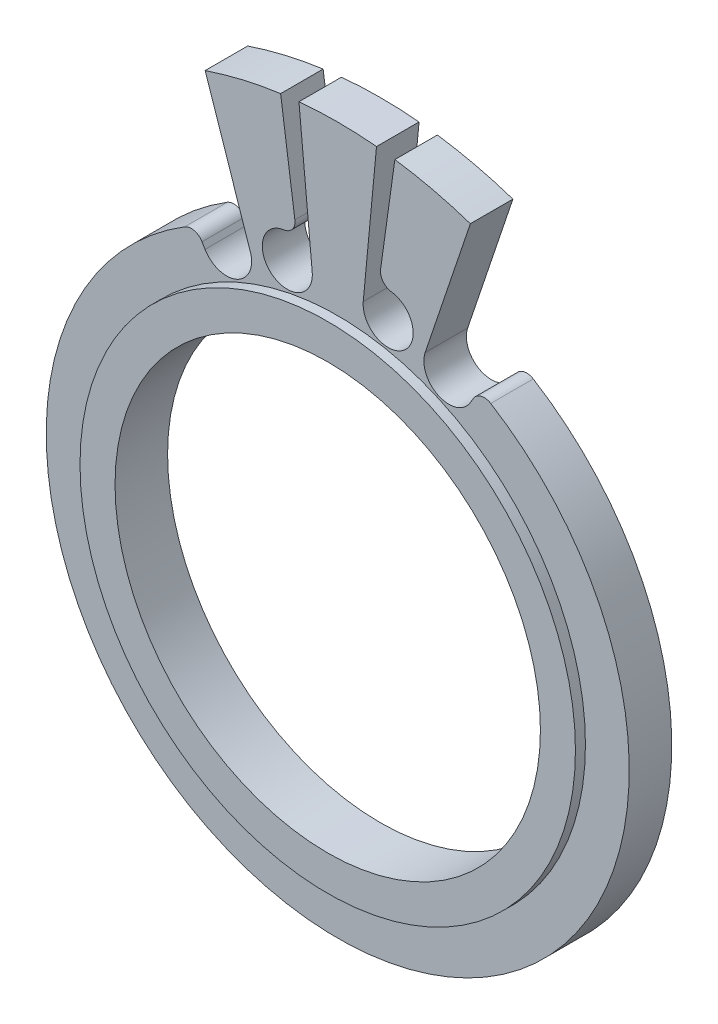
from build123d import *

# Parameters (mm, degrees)
ESQUISSE1_R        = 17
BOSS_EXTRU_1_DEPTH = 3.4
ESQUISSE2_R        = 19.8
ESQUISSE2_R_2      = 17
BOSS_EXTRU_2_DEPTH = 0.8


with BuildPart() as part:
    # Esquisse1 → Boss.-Extru.1 (new body)
    with BuildSketch(Plane.XY):
        with BuildLine():
            Line((10.604819554, 19.085304433), (10.844597942, 19.490397698))
            ThreePointArc((10.844597942, 19.490397698), (11.465620902, 19.951920532), (12.230041829, 19.832197983))
            ThreePointArc((12.230041829, 19.832197983), (0, -23.3), (-12.230041829, 19.832197983))
            ThreePointArc((-12.230041829, 19.832197983), (-11.465620902, 19.951920532), (-10.844597942, 19.490397698))
            Line((-10.844597942, 19.490397698), (-10.604819554, 19.085304433))
            ThreePointArc((-10.604819554, 19.085304433), (-8.050510374, 18.285863427), (-6.988397979, 20.74259267))
            Line((-6.988397979, 20.74259267), (-10.6, 31.462358462))
            ThreePointArc((-10.6, 31.462358462), (-7.615939872, 32.314663233), (-4.565333975, 32.884612294))
            Line((-4.565333975, 32.884612294), (-3.426014723, 24.718632018))
            ThreePointArc((-3.426014723, 24.718632018), (-3.621264858, 23.974046302), (-4.287669622, 23.58877342))
            ThreePointArc((-4.287669622, 23.58877342), (-5.278203354, 20.042601197), (-2.038983016, 21.793014323))
            Line((-2.038983016, 21.793014323), (-3.1, 33.054954243))
            ThreePointArc((-3.1, 33.054954243), (0, 33.2), (3.1, 33.054954243))
            Line((3.1, 33.054954243), (2.038983016, 21.793014323))
            ThreePointArc((2.038983016, 21.793014323), (5.278203354, 20.042601197), (4.287669622, 23.58877342))
            ThreePointArc((4.287669622, 23.58877342), (3.621264858, 23.974046302), (3.426014723, 24.718632018))
            Line((3.426014723, 24.718632018), (4.565333975, 32.884612294))
            ThreePointArc((4.565333975, 32.884612294), (7.615939872, 32.314663233), (10.6, 31.462358462))
            Line((10.6, 31.462358462), (6.988397979, 20.74259267))
            ThreePointArc((6.988397979, 20.74259267), (8.050510374, 18.285863427), (10.604819554, 19.085304433))
        make_face()
        Circle(ESQUISSE1_R, mode=Mode.SUBTRACT)
    extrude(amount=BOSS_EXTRU_1_DEPTH)

    # Esquisse2 → Boss.-Extru.2 (add)
    with BuildSketch(Plane.XY.offset(3.4)):
        Circle(ESQUISSE2_R)
        Circle(ESQUISSE2_R_2, mode=Mode.SUBTRACT)
    extrude(amount=BOSS_EXTRU_2_DEPTH)


solid = part.part
